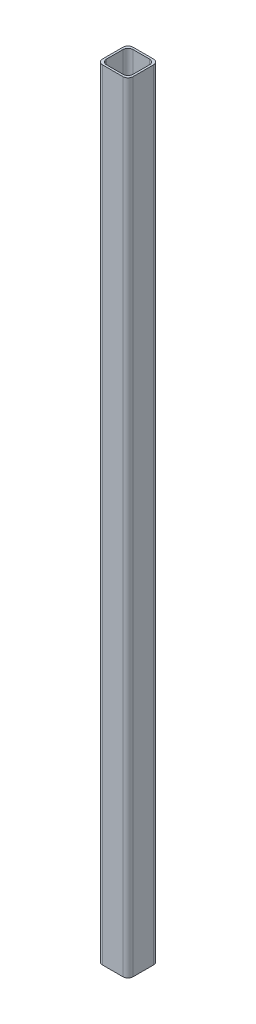
from build123d import *

# Parameters (mm, degrees)
EXTRUDE_1_DEPTH = 1530


with BuildPart() as part:
    # Эскиз1 → Бобышка-Вытянуть1 (new body)
    with BuildSketch(Plane(origin=(0, 0, 0), x_dir=(1, 0, 0), z_dir=(0, 1, 0))):
        with BuildLine():
            Line((-20, 30), (20, 30))
            ThreePointArc((20, 30), (27.071067812, 27.071067812), (30, 20))
            Line((30, 20), (30, -20))
            ThreePointArc((30, -20), (27.071067812, -27.071067812), (20, -30))
            Line((20, -30), (-20, -30))
            ThreePointArc((-20, -30), (-27.071067812, -27.071067812), (-30, -20))
            Line((-30, -20), (-30, 20))
            ThreePointArc((-30, 20), (-27.071067812, 27.071067812), (-20, 30))
        make_face()
        with BuildLine():
            Line((-16, 26), (16, 26))
            ThreePointArc((16, 26), (23.071067812, 23.071067812), (26, 16))
            Line((26, 16), (26, -16))
            ThreePointArc((26, -16), (23.071067812, -23.071067812), (16, -26))
            Line((16, -26), (-16, -26))
            ThreePointArc((-16, -26), (-23.071067812, -23.071067812), (-26, -16))
            Line((-26, -16), (-26, 16))
            ThreePointArc((-26, 16), (-23.071067812, 23.071067812), (-16, 26))
        make_face(mode=Mode.SUBTRACT)
    extrude(amount=EXTRUDE_1_DEPTH)


solid = part.part
